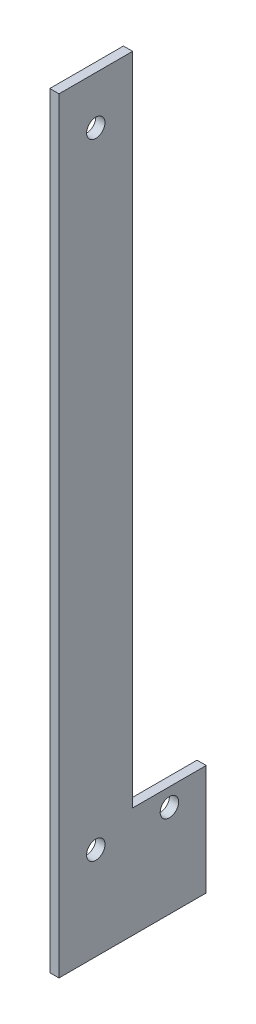
from build123d import *

# Parameters (mm, degrees)
BOSS_EXTRUDE1_DEPTH = 3.175
SKETCH2_R           = 3.175
CUT_EXTRUDE1_DEPTH  = 3.175


with BuildPart() as part:
    # Sketch1 → Boss-Extrude1 (new body)
    with BuildSketch(Plane(origin=(0, 0, 0), x_dir=(0, 0, -1), z_dir=(1, 0, 0))):
        Polygon((0, 0), (25.4, 0), (50.8, 0), (50.8, 38.1), (25.4, 38.1), (25.4, 264.16), (0, 264.16), align=None)
    extrude(amount=BOSS_EXTRUDE1_DEPTH)

    # Sketch2 → Cut-Extrude1 (cut)
    with BuildSketch(Plane(origin=(3.175, 0, 0), x_dir=(0, 0, -1), z_dir=(1, 0, 0))):
        with Locations((12.7, 247.65)):
            Circle(SKETCH2_R)
        with Locations((38.1, 32)):
            Circle(SKETCH2_R)
        with Locations((12.7, 32)):
            Circle(SKETCH2_R)
    extrude(amount=-CUT_EXTRUDE1_DEPTH, mode=Mode.SUBTRACT)


solid = part.part
